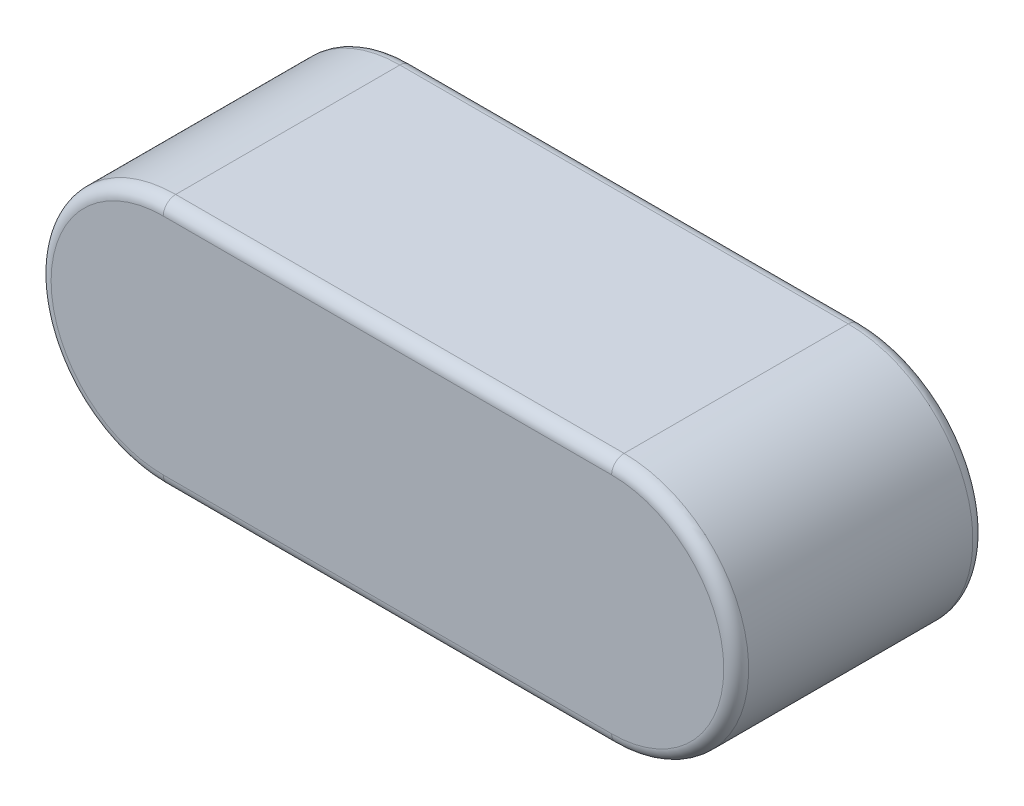
from build123d import *

# Parameters (mm, degrees)
BOSS_EXTRUDE1_DEPTH = 5
FILLET3_R           = 0.25


with BuildPart() as part:
    # Sketch1 → Boss-Extrude1 (new body)
    with BuildSketch(Plane.XY):
        with BuildLine():
            Line((0, 0), (0, 5))
            ThreePointArc((0, 5), (-2.5, 2.5), (0, 0))
        make_face()
        with BuildLine():
            ThreePointArc((9, 0), (11.5, 2.5), (9, 5))
            Line((9, 5), (0, 5))
            ThreePointArc((0, 5), (-2.5, 2.5), (0, 0))
            Line((0, 0), (9, 0))
        make_face()
        with BuildLine():
            Line((9, 0), (9, 5))
            ThreePointArc((9, 5), (11.5, 2.5), (9, 0))
        make_face()
    extrude(amount=BOSS_EXTRUDE1_DEPTH)

    # Fillet3
    fillet3_edges = [part.edges().sort_by_distance(p)[0] for p in [
        (11.5, 2.5, 5),
        (4.5, 5, 5),
        (-2.5, 2.5, 5),
        (-2.5, 2.5, 0),
        (4.5, 0, 5),
        (4.5, 5, 0),
        (11.5, 2.5, 0),
        (4.5, 0, 0),
    ]]
    fillet(fillet3_edges, radius=FILLET3_R)


solid = part.part
